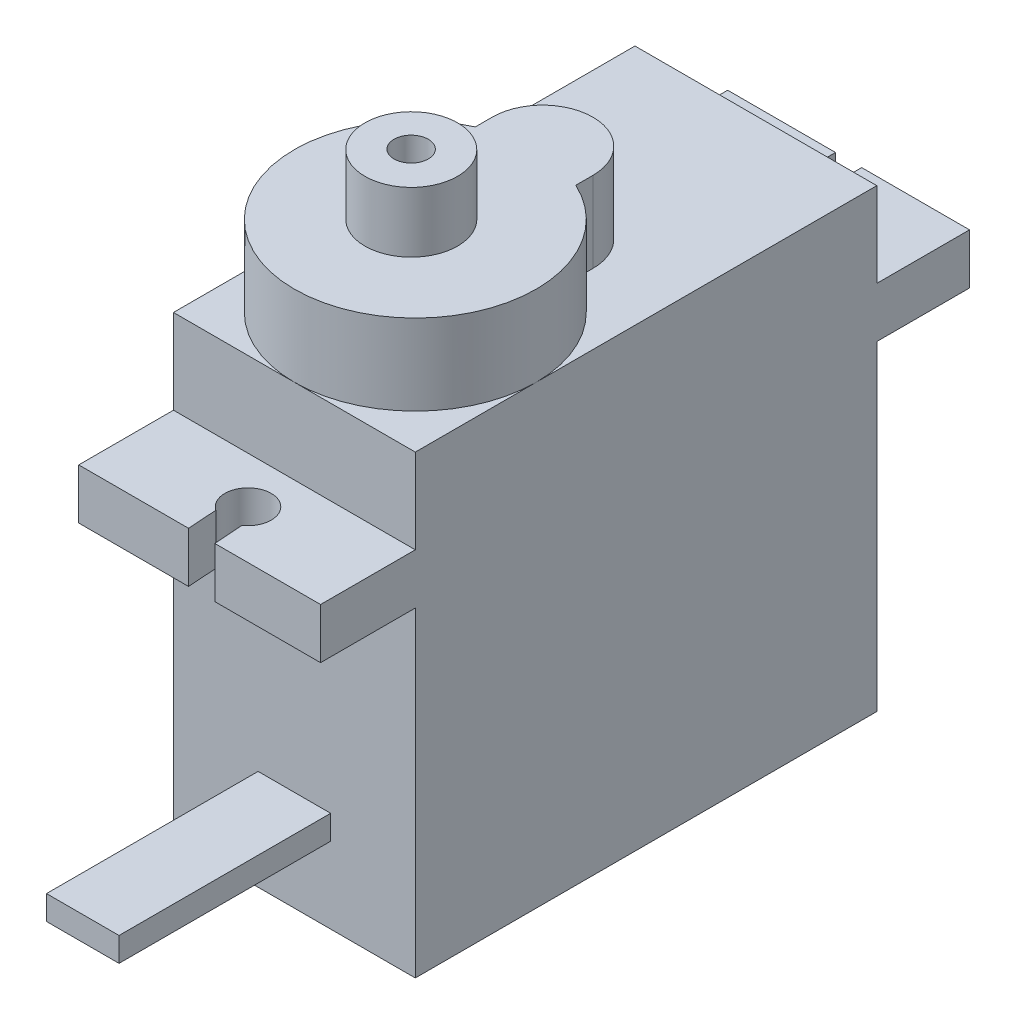
from build123d import *

# Parameters (mm, degrees)
SKETCH2_W           = 12
SKETCH2_H           = 22.9
BOSS_EXTRUDE1_DEPTH = 22.6
SKETCH3_W           = 12
SKETCH3_H           = 2.5
BOSS_EXTRUDE2_DEPTH = 32.2
BOSS_EXTRUDE3_DEPTH = 4
SKETCH7_R           = 2.3
BOSS_EXTRUDE4_DEPTH = 3
CUT_EXTRUDE1_DEPTH  = 2.5
SKETCH10_R          = 0.85
CUT_EXTRUDE2_DEPTH  = 2.5
SKETCH12_W          = 3.6
SKETCH12_H          = 1.2
BOSS_EXTRUDE5_DEPTH = 10.5


with BuildPart() as part:
    # Sketch2 → Boss-Extrude1 (new body)
    with BuildSketch(Plane(origin=(0, 0, 0), x_dir=(1, 0, 0), z_dir=(0, 1, 0))):
        with Locations((6, 11.45)):
            Rectangle(SKETCH2_W, SKETCH2_H)
    extrude(amount=BOSS_EXTRUDE1_DEPTH)

    # Sketch3 → Boss-Extrude2 (add)
    with BuildSketch(Plane.XY.offset(4.7)):
        with Locations((6, 17.15)):
            Rectangle(SKETCH3_W, SKETCH3_H)
    extrude(amount=-BOSS_EXTRUDE2_DEPTH)

    # Sketch5 → Boss-Extrude3 (add)
    with BuildSketch(Plane(origin=(0, 22.6, 0), x_dir=(1, 0, 0), z_dir=(0, 1, 0))):
        with BuildLine():
            Line((3.515017185, 12.299982102), (3.515017185, 11.461214188))
            ThreePointArc((3.515017185, 11.461214188), (5.98348051, 2.2741e-05), (8.515017185, 11.447447894))
            Line((8.515017185, 11.447447894), (8.515017185, 12.299982102))
            ThreePointArc((8.515017185, 12.299982102), (6.015017185, 14.799982102), (3.515017185, 12.299982102))
        make_face()
    extrude(amount=BOSS_EXTRUDE3_DEPTH)

    # Sketch7 → Boss-Extrude4 (add)
    with BuildSketch(Plane(origin=(0, 26.6, 0), x_dir=(1, 0, 0), z_dir=(0, 1, 0))):
        with Locations(Location((5.9, 5.9, 0), (0, 0, 270))):
            Circle(SKETCH7_R)
    extrude(amount=BOSS_EXTRUDE4_DEPTH)

    # Sketch9 → Cut-Extrude1 (cut)
    with BuildSketch(Plane(origin=(0, 18.4, 0), x_dir=(1, 0, 0), z_dir=(0, 1, 0))):
        with BuildLine():
            Line((5.35, 27.5), (6.65, 27.5))
            Line((6.65, 27.5), (6.65, 26.148683298))
            ThreePointArc((6.65, 26.148683298), (6, 24.05), (5.35, 26.148683298))
            Line((5.35, 26.148683298), (5.35, 27.5))
        make_face()
        with BuildLine():
            Line((6.75, -4.7), (6.65, -3.248683298))
            ThreePointArc((6.65, -3.248683298), (6, -1.15), (5.35, -3.248683298))
            Line((5.35, -3.248683298), (5.45, -4.7))
            Line((5.45, -4.7), (6.75, -4.7))
        make_face()
    extrude(amount=-CUT_EXTRUDE1_DEPTH, mode=Mode.SUBTRACT)

    # Sketch10 → Cut-Extrude2 (cut)
    with BuildSketch(Plane(origin=(0, 29.6, 0), x_dir=(1, 0, 0), z_dir=(0, 1, 0))):
        with Locations(Location((5.87814142, 5.916228473, 0), (0, 0, 270))):
            Circle(SKETCH10_R)
    extrude(amount=-CUT_EXTRUDE2_DEPTH, mode=Mode.SUBTRACT)

    # Sketch12 → Boss-Extrude5 (add)
    with BuildSketch(Plane.XY):
        with Locations((6, 4.377974725)):
            Rectangle(SKETCH12_W, SKETCH12_H)
    extrude(amount=BOSS_EXTRUDE5_DEPTH)


solid = part.part
